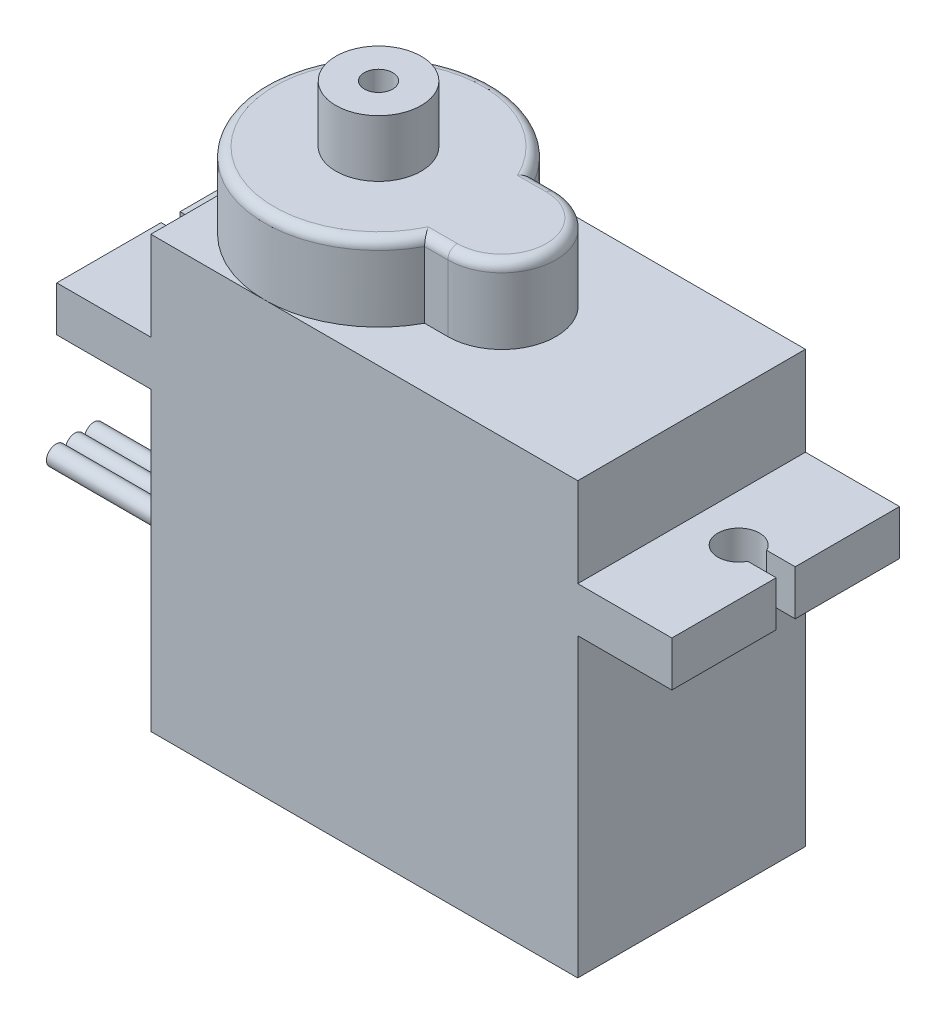
from build123d import *

# Parameters (mm, degrees)
BODY_DEPTH             = 4.7
BODY_DEPTH_BACK        = 18
ESBO_O1_W              = 22.5
ESBO_O1_H              = 12
TABS_DEPTH             = 2.375
TOP_GEAR_HOUSING_DEPTH = 4
ESBO_O4_R              = 2.25
SHAFT_DEPTH            = 3
ESBO_O5_R              = 0.75
SHAFT_HOLE_DEPTH       = 5
FILETE2_R              = 0.5
SKETCH1_R              = 0.5
BOSS_EXTRUDE1_DEPTH    = 10
LPATTERN2_COUNT        = 3
LPATTERN2_PITCH        = 1.001


with BuildPart() as part:
    # Esboço1 → Body (new, two sides: drawn at the far end of the back side and taken through both)
    with BuildSketch(Plane(origin=(0, 0, 0), x_dir=(1, 0, 0), z_dir=(0, 1, 0)).offset(-BODY_DEPTH_BACK)):
        Rectangle(ESBO_O1_W, ESBO_O1_H)
    extrude(amount=BODY_DEPTH + BODY_DEPTH_BACK)

    # Esboço2 → tabs (add)
    with BuildSketch(Plane(origin=(0, 0, 0), x_dir=(1, 0, 0), z_dir=(0, 1, 0))):
        with BuildLine():
            Line((-11.25, 6), (-16.21, 6))
            Line((-16.21, 6), (-16.21, 0.5))
            Line((-16.21, 0.5), (-14.954795897, 0.5))
            ThreePointArc((-14.954795897, 0.5), (-12.875, 0), (-14.954795897, -0.5))
            Line((-14.954795897, -0.5), (-16.21, -0.5))
            Line((-16.21, -0.5), (-16.21, -6))
            Line((-16.21, -6), (-11.25, -6))
            Line((-11.25, -6), (-11.25, 6))
        make_face()
        with BuildLine():
            Line((11.25, 6), (16.21, 6))
            Line((16.21, 6), (16.21, 0.5))
            Line((16.21, 0.5), (14.709795897, 0.5))
            ThreePointArc((14.709795897, 0.5), (12.63, 0), (14.709795897, -0.5))
            Line((14.709795897, -0.5), (16.21, -0.5))
            Line((16.21, -0.5), (16.21, -6))
            Line((16.21, -6), (11.25, -6))
            Line((11.25, -6), (11.25, 6))
        make_face()
    extrude(amount=-TABS_DEPTH)

    # Esboço3 → Top Gear Housing (add)
    with BuildSketch(Plane(origin=(0, 4.7, 0), x_dir=(1, 0, 0), z_dir=(0, 1, 0))):
        with BuildLine():
            Line((0.029914772, 2.85), (1.25, 2.85))
            ThreePointArc((1.25, 2.85), (4.1, 0), (1.25, -2.85))
            Line((1.25, -2.85), (0.029914772, -2.85))
            ThreePointArc((0.029914772, -2.85), (-11.25, 0), (0.029914772, 2.85))
        make_face()
    extrude(amount=TOP_GEAR_HOUSING_DEPTH)

    # Esboço4 → shaft (add)
    with BuildSketch(Plane(origin=(0, 8.7, 0), x_dir=(1, 0, 0), z_dir=(0, 1, 0))):
        with Locations(Location((-5.25, 0, 0), (0, 0, 270))):
            Circle(ESBO_O4_R)
    extrude(amount=SHAFT_DEPTH)

    # Esboço5 → shaft hole (cut)
    with BuildSketch(Plane(origin=(0, 11.7, 0), x_dir=(1, 0, 0), z_dir=(0, 1, 0))):
        with Locations(Location((-5.25, 0, 0), (0, 0, 270))):
            Circle(ESBO_O5_R)
    extrude(amount=-SHAFT_HOLE_DEPTH, mode=Mode.SUBTRACT)

    # Filete2
    filete2_edges = [part.edges().sort_by_distance(p)[0] for p in [
        (-11.25, 8.7, 0),
        (0.639957386, 8.7, 2.85),
        (4.1, 8.7, 0),
        (0.639957386, 8.7, -2.85),
    ]]
    fillet(filete2_edges, radius=FILETE2_R)

    # Sketch1 → Boss-Extrude1 (add)
    with BuildSketch(Plane.ZY.offset(11.25)):
        with Locations((-1, -12.875)):
            Circle(SKETCH1_R)
    boss_extrude1 = extrude(amount=BOSS_EXTRUDE1_DEPTH)

    # LPattern2: Boss-Extrude1 ×3
    with Locations(*[(0, 0, i * LPATTERN2_PITCH) for i in range(1, LPATTERN2_COUNT)]):
        add(boss_extrude1)


solid = part.part
